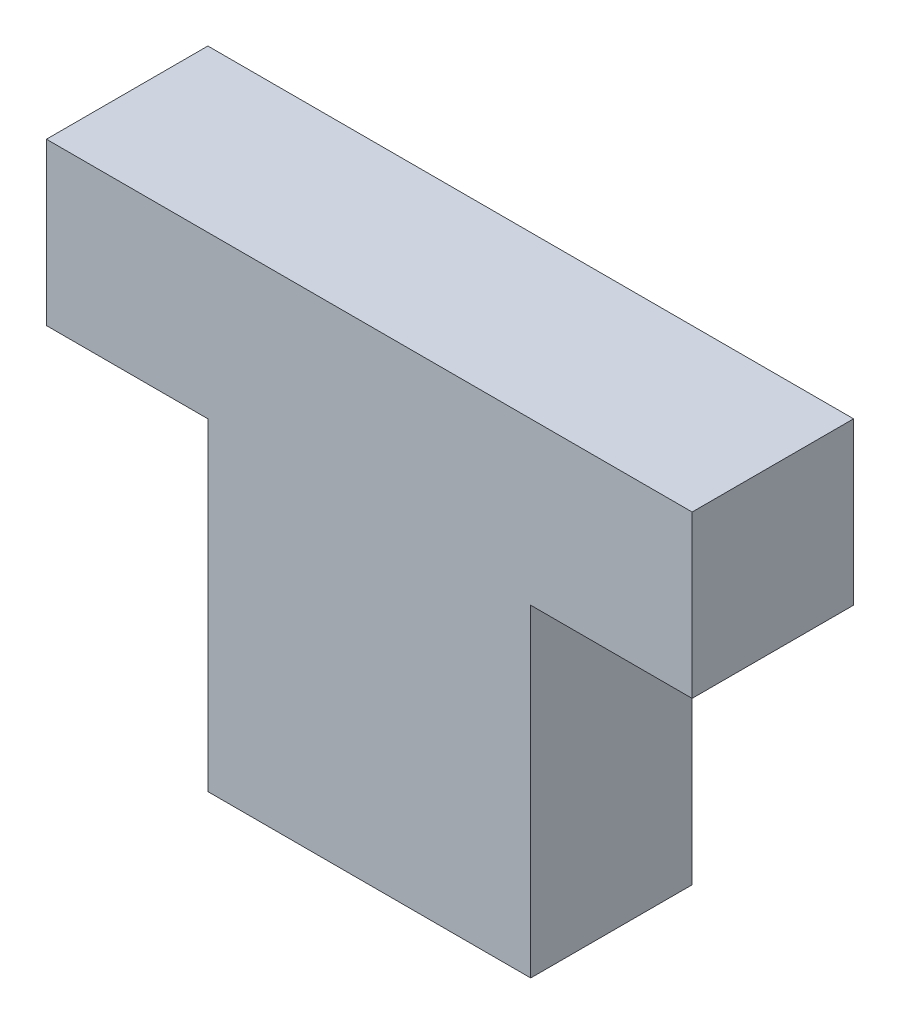
from build123d import *

# Parameters (mm, degrees)
SKETCH1_W           = 10
SKETCH1_H           = 10
BOSS_EXTRUDE1_DEPTH = 5


with BuildPart() as part:
    # Sketch1 → Boss-Extrude1 (new body)
    with BuildSketch(Plane.XY):
        with Locations((-5, -5)):
            Rectangle(SKETCH1_W, SKETCH1_H)
        Polygon((-10, 0), (0, 0), (5, 0), (5, 5), (-15, 5), (-15, 0), align=None)
    extrude(amount=BOSS_EXTRUDE1_DEPTH)


solid = part.part
